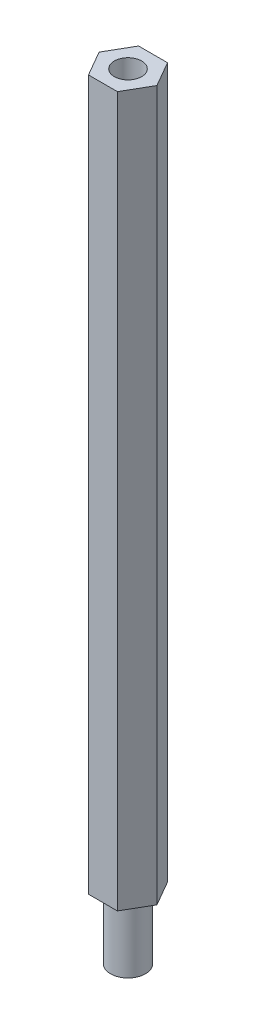
from build123d import *

# Parameters (mm, degrees)
EXTRUDE_1_DEPTH     = 65
SKETCH_6_R          = 1.6
EXTRUDE_2_DEPTH     = 6
SKETCH_7_R          = 1.25
CUT_EXTRUDE_1_DEPTH = 5


with BuildPart() as part:
    # 草图4 → 凸台-拉伸1 (new body)
    with BuildSketch(Plane(origin=(0, 0, 0), x_dir=(1, 0, 0), z_dir=(0, 1, 0))):
        Polygon((1.325, -2.29496732), (2.65, 0), (1.325, 2.29496732), (-1.325, 2.29496732), (-2.65, 0), (-1.325, -2.29496732), align=None)
    extrude(amount=EXTRUDE_1_DEPTH)

    # 草图6 → 凸台-拉伸2 (add)
    with BuildSketch(Plane(origin=(0, 0, 0), x_dir=(-1, 0, 0), z_dir=(0, -1, 0))):
        with Locations(Location((0, 0, 0), (0, 0, 270))):
            Circle(SKETCH_6_R)
    extrude(amount=EXTRUDE_2_DEPTH)

    # 草图7 → 切除-拉伸1 (cut)
    with BuildSketch(Plane(origin=(0, 65, 0), x_dir=(1, 0, 0), z_dir=(0, 1, 0))):
        with Locations(Location((0, 0, 0), (0, 0, 270))):
            Circle(SKETCH_7_R)
    extrude(amount=-CUT_EXTRUDE_1_DEPTH, mode=Mode.SUBTRACT)


solid = part.part
